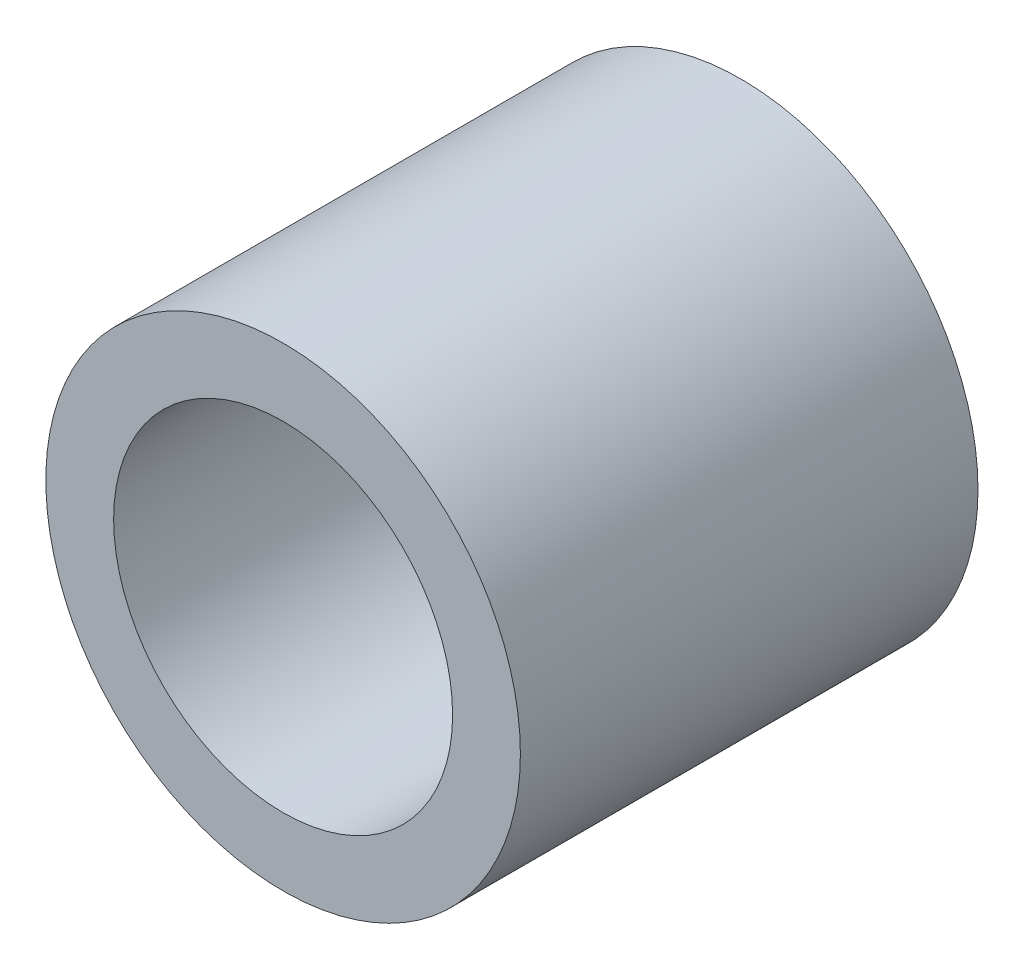
from build123d import *

# Parameters (mm, degrees)
SKETCH1_R           = 3.5
SKETCH1_R_2         = 2.5
BOSS_EXTRUDE1_DEPTH = 6.75


with BuildPart() as part:
    # Sketch1 → Boss-Extrude1 (new body)
    with BuildSketch(Plane.XY):
        Circle(SKETCH1_R)
        Circle(SKETCH1_R_2, mode=Mode.SUBTRACT)
    extrude(amount=BOSS_EXTRUDE1_DEPTH)


solid = part.part
